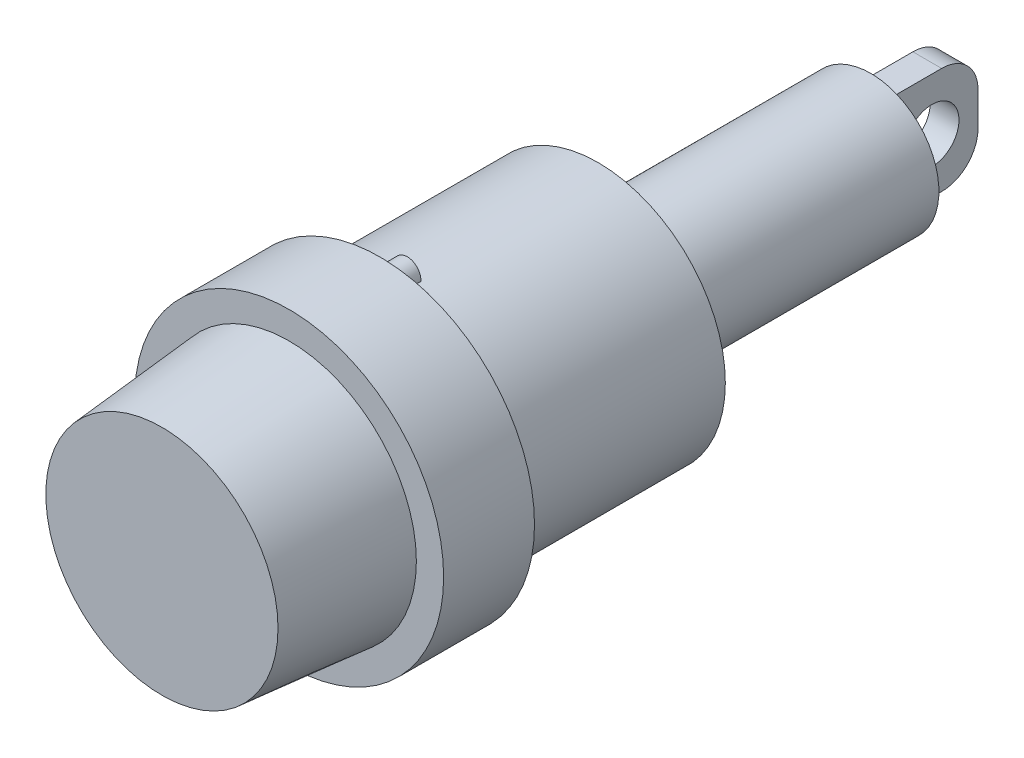
from build123d import *

# Parameters (mm, degrees)
SKETCH_1_R          = 8.5
EXTRUDE_1_DEPTH     = 5
SKETCH_2_R          = 7
EXTRUDE_2_DEPTH     = 7
EXTRUDE_2_TAPER     = 5
SKETCH_3_R          = 7
EXTRUDE_3_DEPTH     = 12
SKETCH_4_R          = 3.75
EXTRUDE_4_DEPTH     = 15
SKETCH_5_W          = 1.582755529
SKETCH_5_H          = 5.869385088
EXTRUDE_5_DEPTH     = 5
SKETCH_6_R          = 1.484108277
CUT_EXTRUDE_1_DEPTH = 5
FILLET_1_R          = 2
SKETCH_7_R          = 0.75
EXTRUDE_6_DEPTH     = 1.5


with BuildPart() as part:
    # Эскиз1 → Бобышка-Вытянуть1 (new body)
    with BuildSketch(Plane.XY):
        Circle(SKETCH_1_R)
    extrude(amount=EXTRUDE_1_DEPTH)

    # Эскиз2 → Бобышка-Вытянуть2 (add)
    with BuildSketch(Plane.XY.offset(5)):
        Circle(SKETCH_2_R)
    extrude(amount=EXTRUDE_2_DEPTH, taper=EXTRUDE_2_TAPER)

    # Эскиз3 → Бобышка-Вытянуть3 (add)
    with BuildSketch(Plane(origin=(0, 0, 0), x_dir=(-1, 0, 0), z_dir=(0, 0, -1))):
        with Locations(Location((0, 0, 0), (0, 0, 180))):
            Circle(SKETCH_3_R)
    extrude(amount=EXTRUDE_3_DEPTH)

    # Эскиз4 → Бобышка-Вытянуть4 (add)
    with BuildSketch(Plane(origin=(0, 0, -12), x_dir=(-1, 0, 0), z_dir=(0, 0, -1))):
        Circle(SKETCH_4_R)
    extrude(amount=EXTRUDE_4_DEPTH)

    # Эскиз5 → Бобышка-Вытянуть5 (add)
    with BuildSketch(Plane(origin=(0, 0, -27), x_dir=(-1, 0, 0), z_dir=(0, 0, -1))):
        with Locations((-0.109913578, 0)):
            Rectangle(SKETCH_5_W, SKETCH_5_H)
    extrude(amount=EXTRUDE_5_DEPTH)

    # Эскиз6 → Вырез-Вытянуть1 (cut)
    with BuildSketch(Plane(origin=(0.901291343, 0, 0), x_dir=(0, 0, -1), z_dir=(1, 0, 0))):
        with Locations((29.467495163, 0)):
            Circle(SKETCH_6_R)
    extrude(amount=-CUT_EXTRUDE_1_DEPTH, mode=Mode.SUBTRACT)

    # Скругление1
    fillet_1_edges = [part.edges().sort_by_distance(p)[0] for p in [
        (0.109913578, -2.934692544, -32),
        (0.109913578, 2.934692544, -32),
    ]]
    fillet(fillet_1_edges, radius=FILLET_1_R)

    # Эскиз7 → Бобышка-Вытянуть6 (add)
    with BuildSketch(Plane(origin=(0, 0, 0), x_dir=(-1, 0, 0), z_dir=(0, 0, -1))):
        with Locations((0, 7.010668314)):
            Circle(SKETCH_7_R)
    extrude(amount=EXTRUDE_6_DEPTH)


solid = part.part
